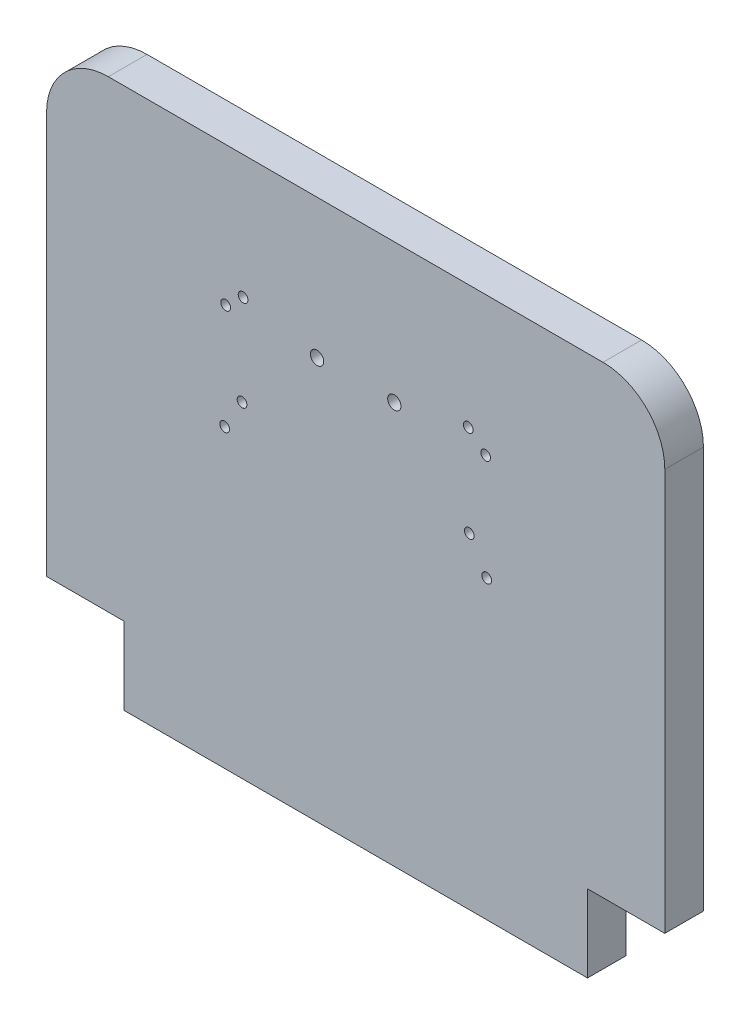
from build123d import *

# Parameters (mm, degrees)
SKETCH1_R           = 1.0922
SKETCH1_R_2         = 0.8
BOSS_EXTRUDE1_DEPTH = 6.35
FILLET1_R           = 10.16


with BuildPart() as part:
    # Sketch1 → Boss-Extrude1 (new body)
    with BuildSketch(Plane.XY):
        Polygon((88.9, 0), (101.6, 0), (101.6, 76.2), (0, 76.2), (0, 0), (12.7, 0), (12.7, -12.7), (88.9, -12.7), align=None)
        with Locations((44.45, 53.34)):
            Circle(SKETCH1_R, mode=Mode.SUBTRACT)
        with Locations(Location((57.15, 53.34, 0), (0, 0, 180))):
            Circle(SKETCH1_R, mode=Mode.SUBTRACT)
        with Locations((32.3, 55.88)):
            Circle(SKETCH1_R_2, mode=Mode.SUBTRACT)
        with Locations(Location((69.3, 55.88, 0), (0, 0, 180))):
            Circle(SKETCH1_R_2, mode=Mode.SUBTRACT)
        with Locations((32.125311619, 40.88)):
            Circle(SKETCH1_R_2, mode=Mode.SUBTRACT)
        with Locations(Location((69.474688381, 40.88, 0), (0, 0, 180))):
            Circle(SKETCH1_R_2, mode=Mode.SUBTRACT)
        with Locations((29.4386, 53.34)):
            Circle(SKETCH1_R_2, mode=Mode.SUBTRACT)
        with Locations((29.263911619, 35.9540048)):
            Circle(SKETCH1_R_2, mode=Mode.SUBTRACT)
        with Locations(Location((72.336088381, 35.9540048, 0), (0, 0, 180))):
            Circle(SKETCH1_R_2, mode=Mode.SUBTRACT)
        with Locations(Location((72.1614, 53.34, 0), (0, 0, 180))):
            Circle(SKETCH1_R_2, mode=Mode.SUBTRACT)
    extrude(amount=BOSS_EXTRUDE1_DEPTH)

    # Fillet1
    fillet1_edges = [part.edges().sort_by_distance(p)[0] for p in [
        (0, 76.2, 3.175),
        (101.6, 76.2, 3.175),
    ]]
    fillet(fillet1_edges, radius=FILLET1_R)


solid = part.part
